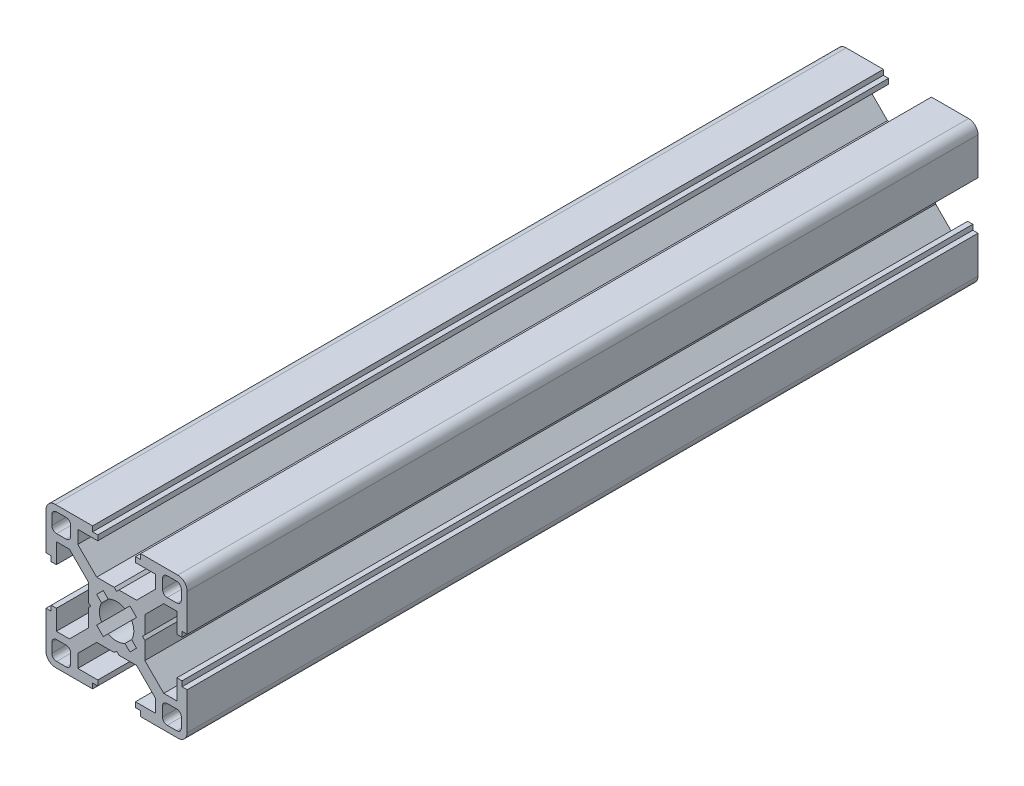
from build123d import *

# Parameters (mm, degrees)
SKETCH1_R                = 3.65
SKETCH1_W                = 4
SKETCH1_H                = 4
BOSS_EXTRUDE1_DEPTH      = 168
FILLET1_R                = 1
CIRPATTERN1_COUNT        = 4
FILLET1_OF_CIRPATTERN1_R = 1
CUT_EXTRUDE1_DEPTH       = 170.3339895
CUT_EXTRUDE2_DEPTH       = 170.3339895
CIRPATTERN2_COUNT        = 4


with BuildPart() as part:
    # Sketch1 → Boss-Extrude1 (new body)
    with BuildSketch(Plane.XY):
        with BuildLine():
            Line((5.1, 15), (13, 15))
            ThreePointArc((13, 15), (14.414213562, 14.414213562), (15, 13))
            Line((15, 13), (15, 5.1))
            Line((15, 5.1), (13.9, 5.1))
            Line((13.9, 5.1), (13.9, 4))
            Line((13.9, 4), (12.8, 4))
            Line((12.8, 4), (12.8, 8.25))
            Line((12.8, 8.25), (10.017766953, 8.25))
            Line((10.017766953, 8.25), (6, 4.232233047))
            Line((6, 4.232233047), (6, -6))
            Line((6, -6), (-6, -6))
            Line((-6, -6), (-6, 6))
            Line((-6, 6), (4.232233047, 6))
            Line((4.232233047, 6), (8.25, 10.017766953))
            Line((8.25, 10.017766953), (8.25, 12.8))
            Line((8.25, 12.8), (4, 12.8))
            Line((4, 12.8), (4, 13.9))
            Line((4, 13.9), (5.1, 13.9))
            Line((5.1, 13.9), (5.1, 15))
        make_face()
        with Locations(Location((0, 0, 0), (0, 0, 180))):
            Circle(SKETCH1_R, mode=Mode.SUBTRACT)
        with Locations((11.75, 11.75)):
            Rectangle(SKETCH1_W, SKETCH1_H, mode=Mode.SUBTRACT)
    boss_extrude1 = extrude(amount=BOSS_EXTRUDE1_DEPTH)

    # Fillet1
    fillet1_edges = [part.edges().sort_by_distance(p)[0] for p in [
        (9.75, 13.75, 84),
        (9.75, 9.75, 84),
        (13.75, 9.75, 84),
        (13.75, 13.75, 84),
    ]]
    fillet(fillet1_edges, radius=FILLET1_R)

    # CirPattern1: Boss-Extrude1 ×4 about axis
    cirpattern1_axis = Axis((0, 0, 0), (0, 0, 1))
    for i in range(1, CIRPATTERN1_COUNT):
        add(boss_extrude1.rotate(cirpattern1_axis, i * 360 / CIRPATTERN1_COUNT))

    # Fillet1 of CirPattern1
    fillet1_of_cirpattern1_edges = [part.edges().sort_by_distance(p)[0] for p in [
        (-13.75, 9.75, 84),
        (-9.75, 9.75, 84),
        (-9.75, 13.75, 84),
        (-13.75, 13.75, 84),
        (-9.75, -13.75, 84),
        (-9.75, -9.75, 84),
        (-13.75, -9.75, 84),
        (-13.75, -13.75, 84),
        (13.75, -9.75, 84),
        (9.75, -9.75, 84),
        (9.75, -13.75, 84),
        (13.75, -13.75, 84),
    ]]
    fillet(fillet1_of_cirpattern1_edges, radius=FILLET1_OF_CIRPATTERN1_R)

    # Sketch2 → Cut-Extrude1 (cut, through all)
    with BuildSketch(Plane(origin=(0, 0, 0), x_dir=(-1, 0, 0), z_dir=(0, 0, -1))):
        Polygon((0, 5.5), (-0.5, 6), (0.5, 6), align=None)
    cut_extrude1 = extrude(amount=-CUT_EXTRUDE1_DEPTH, mode=Mode.SUBTRACT)

    # Sketch3 → Cut-Extrude2 (cut, through all)
    with BuildSketch(Plane(origin=(0, 0, 0), x_dir=(-1, 0, 0), z_dir=(0, 0, -1))):
        with BuildLine():
            Line((-1.775079755, 3.189293317), (-2.828427125, 4.242640687))
            Line((-2.828427125, 4.242640687), (-4.242640687, 2.828427125))
            Line((-4.242640687, 2.828427125), (-3.189293317, 1.775079755))
            ThreePointArc((-3.189293317, 1.775079755), (-2.580939751, 2.580939751), (-1.775079755, 3.189293317))
        make_face()
    cut_extrude2 = extrude(amount=-CUT_EXTRUDE2_DEPTH, mode=Mode.SUBTRACT)

    # CirPattern2: Cut-Extrude1, Cut-Extrude2 ×4 about axis
    cirpattern2_axis = Axis((0, 0, 0), (0, 0, 1))
    add([cut_extrude1.rotate(cirpattern2_axis, i * 360 / CIRPATTERN2_COUNT) for i in range(1, CIRPATTERN2_COUNT)], mode=Mode.SUBTRACT)
    add([cut_extrude2.rotate(cirpattern2_axis, i * 360 / CIRPATTERN2_COUNT) for i in range(1, CIRPATTERN2_COUNT)], mode=Mode.SUBTRACT)


solid = part.part
